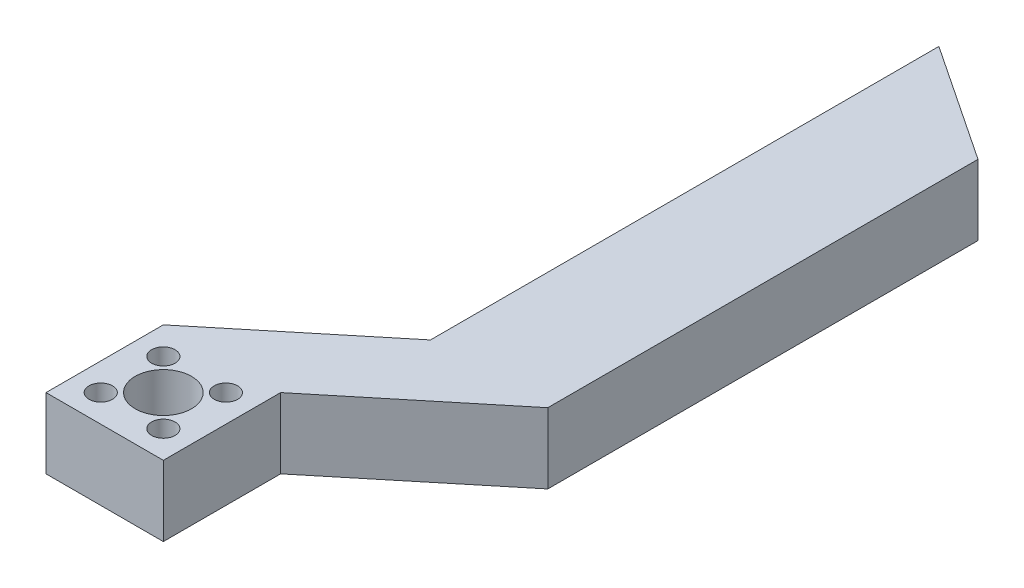
from build123d import *

# Parameters (mm, degrees)
CROQUIS1_R              = 1.5
CROQUIS1_R_2            = 3.6
SALIENTE_EXTRUIR2_DEPTH = 9


with BuildPart() as part:
    # Croquis1 → Saliente-Extruir2 (new body)
    with BuildSketch(Plane(origin=(0, 0, 0), x_dir=(1, 0, 0), z_dir=(0, 1, 0))):
        Polygon((7.75, 7.5), (26.5, 22.904273087), (26.5, 77.904273087), (26.5, 87.904273087), (41.5, 77.904273087), (41.5, 22.904273087), (22.75, 7.5), (22.75, -7.5), (7.75, -7.5), align=None)
        with Locations(Location((19.25, 4, 0), (0, 0, 270))):
            Circle(CROQUIS1_R, mode=Mode.SUBTRACT)
        with Locations(Location((19.25, -4, 0), (0, 0, 270))):
            Circle(CROQUIS1_R, mode=Mode.SUBTRACT)
        with Locations(Location((11.25, -4, 0), (0, 0, 270))):
            Circle(CROQUIS1_R, mode=Mode.SUBTRACT)
        with Locations(Location((11.25, 4, 0), (0, 0, 270))):
            Circle(CROQUIS1_R, mode=Mode.SUBTRACT)
        with Locations(Location((15.25, 0, 0), (0, 0, 270))):
            Circle(CROQUIS1_R_2, mode=Mode.SUBTRACT)
    extrude(amount=SALIENTE_EXTRUIR2_DEPTH)


solid = part.part
